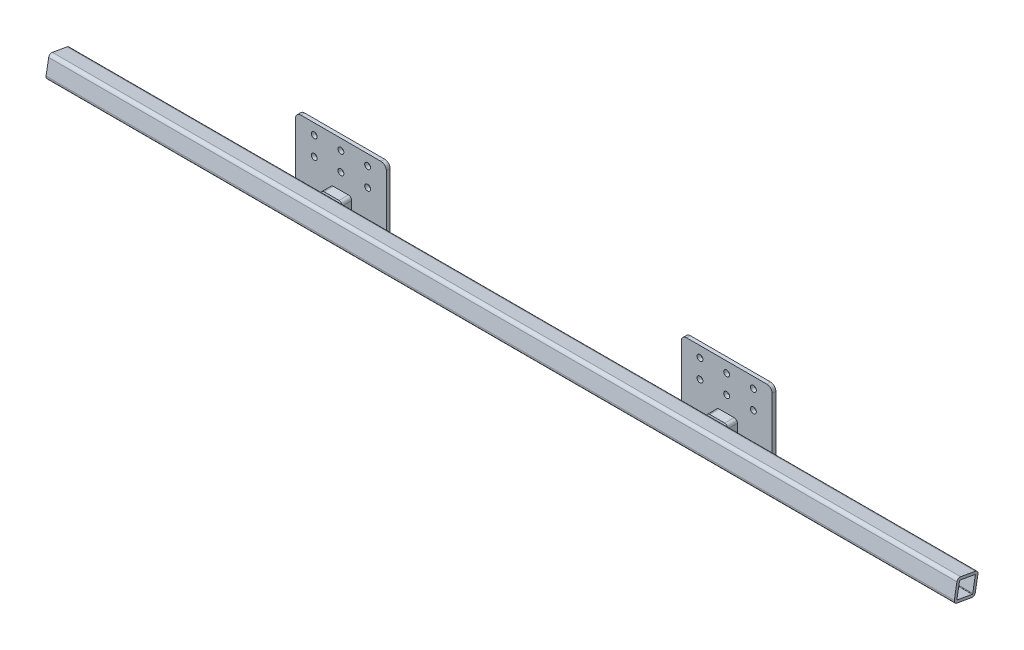
from build123d import *

# Parameters (mm, degrees)
DODANIE_WYCI_GNI_CIE1_DEPTH        = 5
DODANIE_WYCI_GNI_CIE1_DEPTH_BACK   = 2
SZKIC1_R                           = 5.5
DODANIE_WYCI_GNI_CIE1_2_DEPTH      = 5
DODANIE_WYCI_GNI_CIE1_2_DEPTH_BACK = 2
DODANIE_WYCI_GNI_CIE2_DEPTH        = 850
DODANIE_WYCI_GNI_CIE2_DEPTH_BACK   = 850
DODANIE_WYCI_GNI_CIE3_REACH        = 864.19
OTW_R_GWINTOWANY_M101_AT_2_COUNT   = 2
OTW_R_GWINTOWANY_M101_AT_2_PITCH   = 1600


with BuildPart() as part:
    # Szkic1 → Dodanie-wyciągnięcie1 (new, two sides: drawn at the far end of the back side and taken through both)
    with BuildSketch(Plane.XY.offset(-DODANIE_WYCI_GNI_CIE1_DEPTH_BACK)):
        with BuildLine():
            Line((-436, 0), (-286, 0))
            ThreePointArc((-286, 0), (-278.928932188, 2.928932188), (-276, 10))
            Line((-276, 10), (-276, 120))
            ThreePointArc((-276, 120), (-278.928932188, 127.071067812), (-286, 130))
            Line((-286, 130), (-436, 130))
            ThreePointArc((-436, 130), (-443.071067812, 127.071067812), (-446, 120))
            Line((-446, 120), (-446, 10))
            ThreePointArc((-446, 10), (-443.071067812, 2.928932188), (-436, 0))
        make_face()
        with Locations((-411, 110)):
            Circle(SZKIC1_R, mode=Mode.SUBTRACT)
        with Locations((-361, 110)):
            Circle(SZKIC1_R, mode=Mode.SUBTRACT)
        with Locations((-311, 110)):
            Circle(SZKIC1_R, mode=Mode.SUBTRACT)
        with Locations((-411, 75)):
            Circle(SZKIC1_R, mode=Mode.SUBTRACT)
        with Locations((-361, 75)):
            Circle(SZKIC1_R, mode=Mode.SUBTRACT)
        with Locations((-311, 75)):
            Circle(SZKIC1_R, mode=Mode.SUBTRACT)
    extrude(amount=DODANIE_WYCI_GNI_CIE1_DEPTH + DODANIE_WYCI_GNI_CIE1_DEPTH_BACK)


with BuildPart() as body_2:
    # Szkic1 → Dodanie-wyci_gni_cie1 2 (new, two sides: drawn at the far end of the back side and taken through both)
    with BuildSketch(Plane.XY.offset(-DODANIE_WYCI_GNI_CIE1_2_DEPTH_BACK)):
        with BuildLine():
            Line((276, 10), (276, 120))
            ThreePointArc((276, 120), (278.928932188, 127.071067812), (286, 130))
            Line((286, 130), (436, 130))
            ThreePointArc((436, 130), (443.071067812, 127.071067812), (446, 120))
            Line((446, 120), (446, 10))
            ThreePointArc((446, 10), (443.071067812, 2.928932188), (436, 0))
            Line((436, 0), (286, 0))
            ThreePointArc((286, 0), (278.928932188, 2.928932188), (276, 10))
        make_face()
        with Locations(Location((311, 110, 0), (0, 0, 180))):
            Circle(SZKIC1_R, mode=Mode.SUBTRACT)
        with Locations(Location((361, 110, 0), (0, 0, 180))):
            Circle(SZKIC1_R, mode=Mode.SUBTRACT)
        with Locations(Location((411, 110, 0), (0, 0, 180))):
            Circle(SZKIC1_R, mode=Mode.SUBTRACT)
        with Locations(Location((311, 75, 0), (0, 0, 180))):
            Circle(SZKIC1_R, mode=Mode.SUBTRACT)
        with Locations(Location((361, 75, 0), (0, 0, 180))):
            Circle(SZKIC1_R, mode=Mode.SUBTRACT)
        with Locations(Location((411, 75, 0), (0, 0, 180))):
            Circle(SZKIC1_R, mode=Mode.SUBTRACT)
    extrude(amount=DODANIE_WYCI_GNI_CIE1_2_DEPTH + DODANIE_WYCI_GNI_CIE1_2_DEPTH_BACK)


with BuildPart() as body_3:
    # Szkic2 → Dodanie-wyciągnięcie2 (new, two sides: drawn at the far end of the back side and taken through both)
    with BuildSketch(Plane(origin=(0, 0, 0), x_dir=(0, 0, -1), z_dir=(1, 0, 0)).offset(-DODANIE_WYCI_GNI_CIE2_DEPTH_BACK)):
        with BuildLine():
            Line((-28.543754975, 45.434199186), (-56.118372059, 50.296348161))
            ThreePointArc((-56.118372059, 50.296348161), (-60.601719743, 49.302413909), (-63.069107643, 45.429390709))
            Line((-63.069107643, 45.429390709), (-67.931256618, 17.854773625))
            ThreePointArc((-67.931256618, 17.854773625), (-66.937322366, 13.371425941), (-63.064299166, 10.904038041))
            Line((-63.064299166, 10.904038041), (-35.489682082, 6.041889066))
            ThreePointArc((-35.489682082, 6.041889066), (-31.006334398, 7.035823318), (-28.538946498, 10.908846518))
            Line((-28.538946498, 10.908846518), (-23.676797523, 38.483463602))
            ThreePointArc((-23.676797523, 38.483463602), (-24.670731775, 42.966811287), (-28.543754975, 45.434199186))
        make_face()
        with BuildLine():
            Line((-29.411995863, 40.510160421), (-56.986612948, 45.372309396))
            ThreePointArc((-56.986612948, 45.372309396), (-57.733837562, 45.206653687), (-58.145068878, 44.561149821))
            Line((-58.145068878, 44.561149821), (-63.007217853, 16.986532736))
            ThreePointArc((-63.007217853, 16.986532736), (-62.841562144, 16.239308122), (-62.196058278, 15.828076806))
            Line((-62.196058278, 15.828076806), (-34.621441193, 10.965927831))
            ThreePointArc((-34.621441193, 10.965927831), (-33.874216579, 11.13158354), (-33.462985263, 11.777087406))
            Line((-33.462985263, 11.777087406), (-28.600836288, 39.351704491))
            ThreePointArc((-28.600836288, 39.351704491), (-28.766491997, 40.098929105), (-29.411995863, 40.510160421))
        make_face(mode=Mode.SUBTRACT)
    extrude(amount=DODANIE_WYCI_GNI_CIE2_DEPTH + DODANIE_WYCI_GNI_CIE2_DEPTH_BACK)

    # Szkic5 → Otwór gwintowany M101 (revolve, cut)
    with BuildSketch(Plane(origin=(-800, 8.472963553, 49.276990624), x_dir=(0, -0.17364817766693064, -0.9848077530122081), z_dir=(1, 0, 0))):
        Polygon((0, 0), (0, 30.053657631), (4.25, 27.5), (4.25, 0), align=None)
    otw_r_gwintowany_m101 = revolve(axis=Axis((-800, 2.219434322, 50.379656552), (0, 0.9848077530122081, -0.17364817766693066)), mode=Mode.SUBTRACT)

    # Otwór gwintowany M101 at 2: Otwór gwintowany M101 ×2
    with Locations(*[(i * OTW_R_GWINTOWANY_M101_AT_2_PITCH, 0, 0) for i in range(1, OTW_R_GWINTOWANY_M101_AT_2_COUNT)]):
        add(otw_r_gwintowany_m101, mode=Mode.SUBTRACT)


with BuildPart() as body_4:
    # Dodanie-wyciągnięcie3: up to this plane
    dodanie_wyci_gni_cie3_end = Plane(origin=(-850, 10.908846518, 28.538946498), z_dir=(0, -0.17364817766693066, -0.984807753012208))
    # Szkic3 → Dodanie-wyciągnięcie3 (new, up to the surface)
    with BuildSketch(Plane(origin=(0, 0, 5), x_dir=(-1, 0, 0), z_dir=(0, 0, -1)), mode=Mode.PRIVATE) as dodanie_wyci_gni_cie3_sk1:
        with BuildLine():
            Line((375, 45), (347, 45))
            ThreePointArc((347, 45), (342.757359313, 43.242640687), (341, 39))
            Line((341, 39), (341, 11))
            ThreePointArc((341, 11), (342.757359313, 6.757359313), (347, 5))
            Line((347, 5), (375, 5))
            ThreePointArc((375, 5), (379.242640687, 6.757359313), (381, 11))
            Line((381, 11), (381, 39))
            ThreePointArc((381, 39), (379.242640687, 43.242640687), (375, 45))
        make_face()
        with BuildLine():
            Line((375, 41), (347, 41))
            ThreePointArc((347, 41), (345.585786438, 40.414213562), (345, 39))
            Line((345, 39), (345, 11))
            ThreePointArc((345, 11), (345.585786438, 9.585786438), (347, 9))
            Line((347, 9), (375, 9))
            ThreePointArc((375, 9), (376.414213562, 9.585786438), (377, 11))
            Line((377, 11), (377, 39))
            ThreePointArc((377, 39), (376.414213562, 40.414213562), (375, 41))
        make_face(mode=Mode.SUBTRACT)
    dodanie_wyci_gni_cie3_tool1 = split(extrude(dodanie_wyci_gni_cie3_sk1.sketch, amount=-DODANIE_WYCI_GNI_CIE3_REACH, mode=Mode.PRIVATE), bisect_by=dodanie_wyci_gni_cie3_end, keep=Keep.BOTH, mode=Mode.PRIVATE)
    add(dodanie_wyci_gni_cie3_tool1.solids().sort_by_distance((-361, 44.434315, 5))[0])
    # Szkic3 → Dodanie-wyciągnięcie3 (new, up to the surface)
    with BuildSketch(Plane(origin=(0, 0, 5), x_dir=(-1, 0, 0), z_dir=(0, 0, -1)), mode=Mode.PRIVATE) as dodanie_wyci_gni_cie3_sk2:
        with BuildLine():
            Line((-381, 11), (-381, 39))
            ThreePointArc((-381, 39), (-379.242640687, 43.242640687), (-375, 45))
            Line((-375, 45), (-347, 45))
            ThreePointArc((-347, 45), (-342.757359313, 43.242640687), (-341, 39))
            Line((-341, 39), (-341, 11))
            ThreePointArc((-341, 11), (-342.757359313, 6.757359313), (-347, 5))
            Line((-347, 5), (-375, 5))
            ThreePointArc((-375, 5), (-379.242640687, 6.757359313), (-381, 11))
        make_face()
        with BuildLine():
            Line((-377, 11), (-377, 39))
            ThreePointArc((-377, 39), (-376.414213562, 40.414213562), (-375, 41))
            Line((-375, 41), (-347, 41))
            ThreePointArc((-347, 41), (-345.585786438, 40.414213562), (-345, 39))
            Line((-345, 39), (-345, 11))
            ThreePointArc((-345, 11), (-345.585786438, 9.585786438), (-347, 9))
            Line((-347, 9), (-375, 9))
            ThreePointArc((-375, 9), (-376.414213562, 9.585786438), (-377, 11))
        make_face(mode=Mode.SUBTRACT)
    dodanie_wyci_gni_cie3_tool2 = split(extrude(dodanie_wyci_gni_cie3_sk2.sketch, amount=-DODANIE_WYCI_GNI_CIE3_REACH, mode=Mode.PRIVATE), bisect_by=dodanie_wyci_gni_cie3_end, keep=Keep.BOTH, mode=Mode.PRIVATE)
    add(dodanie_wyci_gni_cie3_tool2.solids().sort_by_distance((361, 5.565685, 5))[0])


solid = Compound([part.part, body_2.part, body_3.part, body_4.part])
